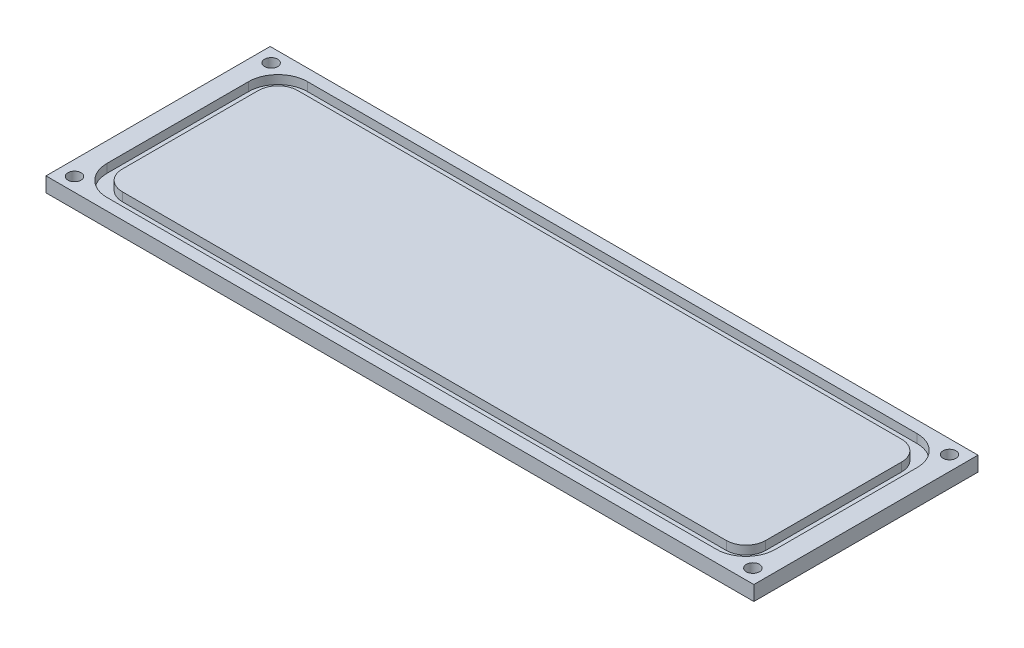
from build123d import *

# Parameters (mm, degrees)
SKETCH1_W                   = 228.6
SKETCH1_H                   = 72.39
BOSS_EXTRUDE1_DEPTH         = 4.7625
SKETCH2_W                   = 215.9
SKETCH2_H                   = 64.77
SKETCH2_W_2                 = 207.772
SKETCH2_H_2                 = 56.642
CUT_EXTRUDE1_DEPTH          = 2.794
FILLET1_R                   = 9.525
FILLET2_R                   = 6.35
F_19_0_166_DIAMETER_HOLE1_D = 4.2164
LPATTERN1_COUNT             = 2
LPATTERN1_PITCH             = 219.075
LPATTERN1_COUNT_DIR2        = 2
LPATTERN1_PITCH_DIR2        = 63.5


with BuildPart() as part:
    # Sketch1 → Boss-Extrude1 (new body)
    with BuildSketch(Plane(origin=(0, 0, 0), x_dir=(1, 0, 0), z_dir=(0, 1, 0))):
        with Locations((114.3, 36.195)):
            Rectangle(SKETCH1_W, SKETCH1_H)
    extrude(amount=BOSS_EXTRUDE1_DEPTH)

    # Sketch2 → Cut-Extrude1 (cut)
    with BuildSketch(Plane(origin=(0, 4.7625, 0), x_dir=(1, 0, 0), z_dir=(0, 1, 0))):
        with Locations((114.3, 36.195)):
            Rectangle(SKETCH2_W, SKETCH2_H)
        with Locations((114.3, 36.195)):
            Rectangle(SKETCH2_W_2, SKETCH2_H_2, mode=Mode.SUBTRACT)
    extrude(amount=-CUT_EXTRUDE1_DEPTH, mode=Mode.SUBTRACT)

    # Fillet1
    fillet1_edges = [part.edges().sort_by_distance(p)[0] for p in [
        (6.35, 3.3655, -3.81),
        (6.35, 3.3655, -68.58),
        (222.25, 3.3655, -68.58),
        (222.25, 3.3655, -3.81),
    ]]
    fillet(fillet1_edges, radius=FILLET1_R)

    # Fillet2
    fillet2_edges = [part.edges().sort_by_distance(p)[0] for p in [
        (10.414, 3.3655, -64.516),
        (218.186, 3.3655, -64.516),
        (218.186, 3.3655, -7.874),
        (10.414, 3.3655, -7.874),
    ]]
    fillet(fillet2_edges, radius=FILLET2_R)

    # #19 (0.166) Diameter Hole1 (through all)
    with Locations(Plane(origin=(0, 4.7625, 0), x_dir=(1, 0, 0), z_dir=(0, 1, 0))):
        with Locations((4.7625, 4.445)):
            f_19_0_166_diameter_hole1 = Hole(F_19_0_166_DIAMETER_HOLE1_D / 2)

    # LPattern1: 19 _0.166_ Diameter Hole1 2 × 2
    with Locations(*[(i * LPATTERN1_PITCH, 0, -j * LPATTERN1_PITCH_DIR2) for i in range(LPATTERN1_COUNT) for j in range(LPATTERN1_COUNT_DIR2) if (i, j) != (0, 0)]):
        add(f_19_0_166_diameter_hole1, mode=Mode.SUBTRACT)


solid = part.part
